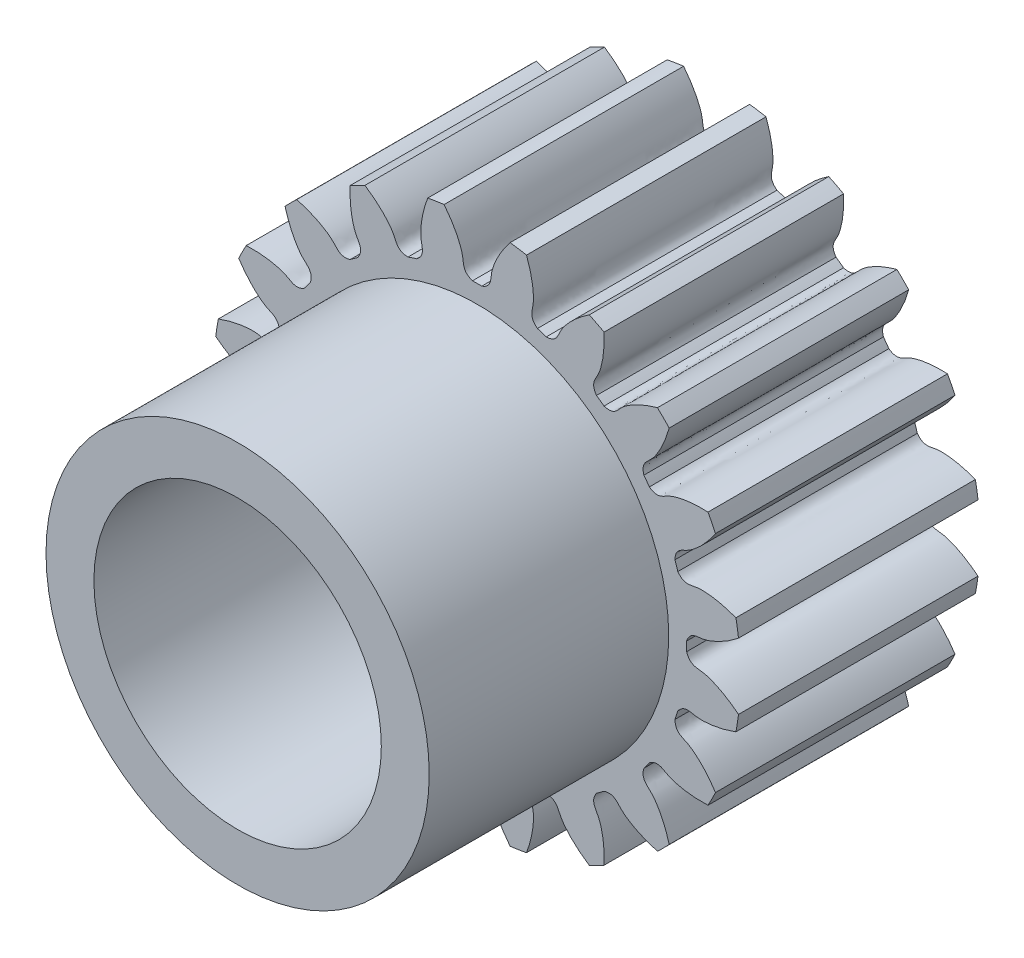
from build123d import *

# Parameters (mm, degrees)
SKETCH_1_R               = 11
EXTRUDE_1_DEPTH          = 10
CUT_EXTRUDE_1_DEPTH      = 19.493242009
PATTERN_CIRCULAR_1_COUNT = 20
SKETCH_4_R               = 8
EXTRUDE_2_DEPTH          = 10
SKETCH_5_R               = 6
CUT_EXTRUDE_2_DEPTH      = 26.26269807


with BuildPart() as part:
    # 草图1 → 凸台-拉伸1 (new body)
    with BuildSketch(Plane.XY):
        Circle(SKETCH_1_R)
    extrude(amount=EXTRUDE_1_DEPTH)

    # 草图2 → 切除-拉伸1 (cut, through all)
    with BuildSketch(Plane.XY):
        with BuildLine():
            ThreePointArc((0.1933166, 8.747864236), (0, 8.75), (-0.1933166, 8.747864236))
            add(Edge.make_bspline(
                [(-0.1933166, 8.747864236), (-0.611189405, 8.893475512), (-0.557084099, 9.187113699), (-0.612897056, 9.470009403), (-0.618892186, 9.497556614), (-0.62631089, 9.528634615), (-0.635292097, 9.563196836), (-0.64597914, 9.601191497), (-0.658512055, 9.642562828), (-0.673029871, 9.687250733), (-0.68966975, 9.735190947), (-0.7085671, 9.786315045), (-0.729855399, 9.840550501), (-0.753666102, 9.897820731), (-0.780128531, 9.958045151), (-0.809369765, 10.021139231), (-0.841514533, 10.087014551), (-0.876685117, 10.155578861), (-0.915001238, 10.22673615), (-0.956579966, 10.300386704), (-1.001535609, 10.376427181), (-1.049979626, 10.454750678), (-1.102020521, 10.535246805), (-1.157763756, 10.617801764), (-1.217311651, 10.70229842), (-1.280763301, 10.78861639), (-1.34821448, 10.876632121), (-1.419757562, 10.966218973), (-1.495481426, 11.057247311), (-1.575471385, 11.149584594), (-1.659809097, 11.243095463), (-1.748572489, 11.337641835), (-1.841835684, 11.433083002), (-1.939668926, 11.529275727), (-2.042138506, 11.626074339), (-2.149306698, 11.723330842), (-2.261231689, 11.820895011), (-2.377967518, 11.918614499), (-2.499564012, 12.016334946), (-2.626066734, 12.113900082), (-2.757516899, 12.21115184), (-2.941473591, 12.341639868), (-3.083932413, 12.436332601), (-3.181157982, 12.49825186)],
                knots=[0, 0, 0, 0, 0.165916003, 0.170905922, 0.176663519, 0.183188797, 0.190481754, 0.198542391, 0.207370708, 0.216966704, 0.22733038, 0.238461736, 0.250360771, 0.263027487, 0.276461881, 0.290663956, 0.30563371, 0.321371144, 0.337876258, 0.355149051, 0.373189524, 0.391997677, 0.411573509, 0.431917021, 0.453028213, 0.474907084, 0.497553636, 0.520967867, 0.545149777, 0.570099367, 0.595816637, 0.622301587, 0.649554216, 0.677574526, 0.706362514, 0.735918183, 0.766241531, 0.797332559, 0.829191267, 0.861817654, 0.895211721, 0.929373468, 1, 1, 1, 1], degree=3))
            ThreePointArc((-3.181157982, 12.49825186), (0, 12.89674632), (3.181157982, 12.49825186))
            add(Edge.make_bspline(
                [(0.1933166, 8.747864236), (0.611189405, 8.893475512), (0.557084099, 9.187113699), (0.612897056, 9.470009403), (0.618892186, 9.497556614), (0.62631089, 9.528634615), (0.635292097, 9.563196836), (0.64597914, 9.601191497), (0.658512055, 9.642562828), (0.673029871, 9.687250733), (0.68966975, 9.735190947), (0.7085671, 9.786315045), (0.729855399, 9.840550501), (0.753666102, 9.897820731), (0.780128531, 9.958045151), (0.809369765, 10.021139231), (0.841514533, 10.087014551), (0.876685117, 10.155578861), (0.915001238, 10.22673615), (0.956579966, 10.300386704), (1.001535609, 10.376427181), (1.049979626, 10.454750678), (1.102020521, 10.535246805), (1.157763756, 10.617801764), (1.217311651, 10.70229842), (1.280763301, 10.78861639), (1.34821448, 10.876632121), (1.419757562, 10.966218973), (1.495481426, 11.057247311), (1.575471385, 11.149584594), (1.659809097, 11.243095463), (1.748572489, 11.337641835), (1.841835684, 11.433083002), (1.939668926, 11.529275727), (2.042138506, 11.626074339), (2.149306698, 11.723330842), (2.261231689, 11.820895011), (2.377967518, 11.918614499), (2.499564012, 12.016334946), (2.626066734, 12.113900082), (2.757516899, 12.21115184), (2.941473591, 12.341639868), (3.083932413, 12.436332601), (3.181157982, 12.49825186)],
                knots=[0, 0, 0, 0, 0.165916003, 0.170905922, 0.176663519, 0.183188797, 0.190481754, 0.198542391, 0.207370708, 0.216966704, 0.22733038, 0.238461736, 0.250360771, 0.263027487, 0.276461881, 0.290663956, 0.30563371, 0.321371144, 0.337876258, 0.355149051, 0.373189524, 0.391997677, 0.411573509, 0.431917021, 0.453028213, 0.474907084, 0.497553636, 0.520967867, 0.545149777, 0.570099367, 0.595816637, 0.622301587, 0.649554216, 0.677574526, 0.706362514, 0.735918183, 0.766241531, 0.797332559, 0.829191267, 0.861817654, 0.895211721, 0.929373468, 1, 1, 1, 1], degree=3))
        make_face()
    cut_extrude_1 = extrude(amount=CUT_EXTRUDE_1_DEPTH, mode=Mode.SUBTRACT)

    # 阵列(圆周)1: 切除-拉伸1 ×20 about axis
    pattern_circular_1_axis = Axis((0, 0, -0.5), (0, 0, 1))
    for i in range(1, PATTERN_CIRCULAR_1_COUNT):
        add(cut_extrude_1.rotate(pattern_circular_1_axis, i * 360 / PATTERN_CIRCULAR_1_COUNT), mode=Mode.SUBTRACT)

    # 草图4 → 凸台-拉伸2 (add)
    with BuildSketch(Plane.XY.offset(10)):
        Circle(SKETCH_4_R)
    extrude(amount=EXTRUDE_2_DEPTH)

    # 草图5 → 切除-拉伸2 (cut, through all)
    with BuildSketch(Plane.XY.offset(20)):
        Circle(SKETCH_5_R)
    extrude(amount=-CUT_EXTRUDE_2_DEPTH, mode=Mode.SUBTRACT)


solid = part.part
